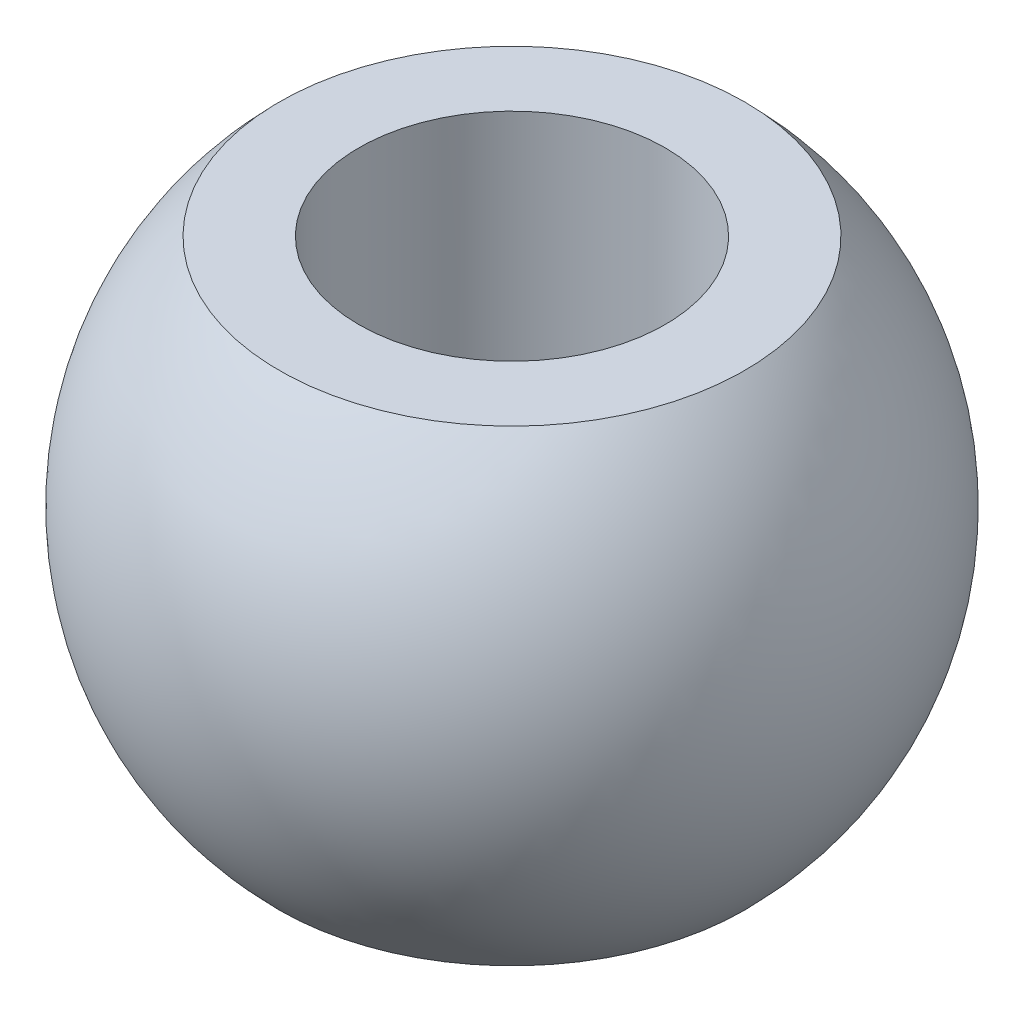
from build123d import *
from build123d.topology import SkipClean

# Parameters (mm, degrees)
CUT_EXTRUDE_1_DEPTH      = 11.998522628
CUT_EXTRUDE_1_DEPTH_BACK = 11.998522628
SKETCH_2_R               = 2.95
CUT_EXTRUDE_2_DEPTH      = 11.998522628
CUT_EXTRUDE_2_DEPTH_BACK = 11.998522628


with BuildPart() as part:
    # Эскиз1 → Повернуть3 (revolve)
    with BuildSketch(Plane(origin=(0, 0, 0), x_dir=(1, 0, 0), z_dir=(0, 1, 0))):
        with BuildLine():
            Line((0, 6.35), (0, -6.35))
            ThreePointArc((0, -6.35), (6.35, 0), (0, 6.35))
        make_face()
    revolve(axis=Axis((0, 0, -6.35), (0, 0, 1)))

    # Эскиз2 → Вырез-Вытянуть1 (cut, two sides: drawn at the far end of the back side and taken through both)
    with BuildSketch(Plane(origin=(0, 0, 0), x_dir=(1, 0, 0), z_dir=(0, 1, 0)).offset(-CUT_EXTRUDE_1_DEPTH_BACK)):
        with Locations(Location((0, 0, 0), (0, 0, 90))):
            Circle(SKETCH_2_R)
    extrude(amount=CUT_EXTRUDE_1_DEPTH + CUT_EXTRUDE_1_DEPTH_BACK, mode=Mode.SUBTRACT)

    # Эскиз3 → Вырез-Вытянуть2 (cut, two sides: drawn at the far end of the back side and taken through both)
    with SkipClean():  # the faces are left unmerged after this step: merging them gives an invalid solid
        with BuildSketch(Plane.XY.offset(-CUT_EXTRUDE_2_DEPTH_BACK)):
            with BuildLine():
                Line((-4.480234369, 4.5), (4.480234369, 4.5))
                ThreePointArc((4.480234369, 4.5), (0, 6.35), (-4.480234369, 4.5))
            make_face()
            with BuildLine():
                Line((-4.480234369, -4.5), (4.480234369, -4.5))
                ThreePointArc((4.480234369, -4.5), (0, -6.35), (-4.480234369, -4.5))
            make_face()
        extrude(amount=CUT_EXTRUDE_2_DEPTH + CUT_EXTRUDE_2_DEPTH_BACK, mode=Mode.SUBTRACT)


solid = part.part
